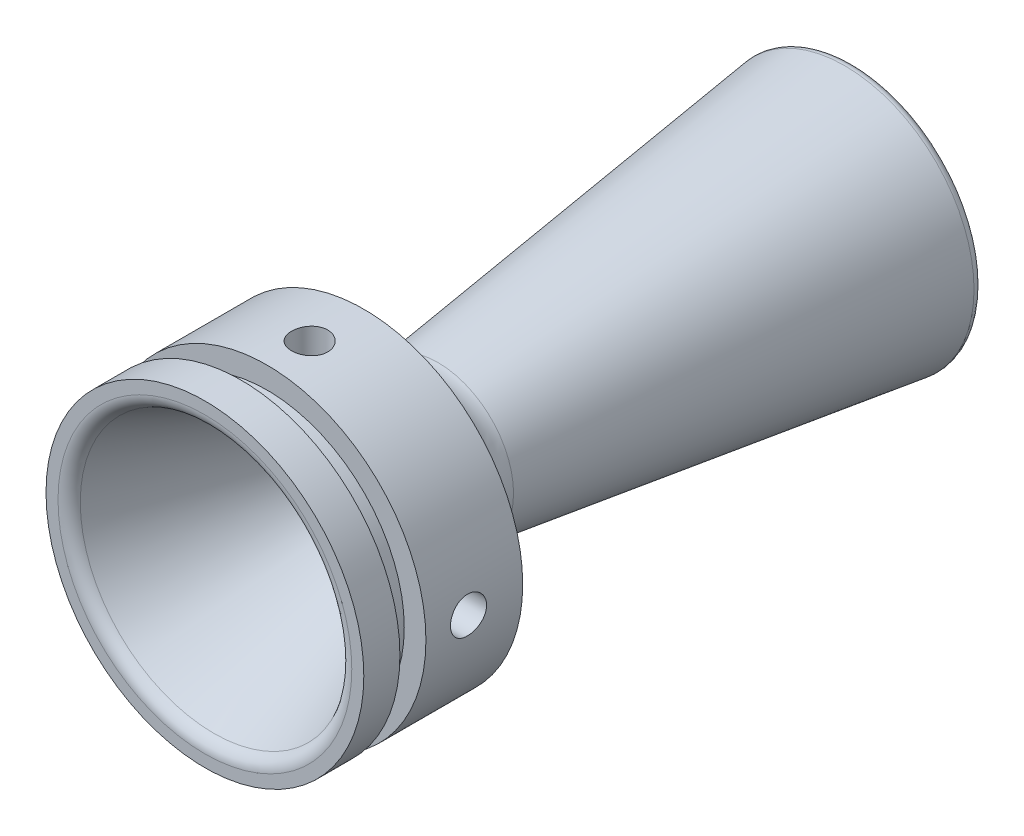
from build123d import *

# Parameters (mm, degrees)
FILETE5_R             = 1
ESBO_O2_R             = 2.5
CORTE_EXTRUS_O1_DEPTH = 5
PADR_OCIRCULAR1_COUNT = 4
FILETE6_R             = 5
FILETE7_R             = 1
FILETE8_R             = 2


with BuildPart() as part:
    # Esboço1 → Revolução1 (revolve)
    with BuildSketch(Plane(origin=(0, 0, 0), x_dir=(1, 0, 0), z_dir=(0, 1, 0))):
        Polygon((-7, -12.473975434), (-15, 48.292057468), (-18.025886882, 48.292057468), (-10.025886882, -12.473975434), (-22, -19.444538182), (-22, -32.844538182), (-19, -32.844538182), (-19, -36.444538182), (-22, -36.444538182), (-22, -41.444538182), (-19, -41.444538182), align=None)
    revolve(axis=Axis((0, 0, 0), (0, 0, -1)))

    # Filete5
    filete5_edges = [part.edges().sort_by_distance(p)[0] for p in [
        (7, 0, 12.473975434),
    ]]
    fillet(filete5_edges, radius=FILETE5_R)

    # Esboço2 → Corte-extrusão1 (cut)
    with BuildSketch(Plane.ZX.offset(22)):
        with Locations((26.944538182, 0)):
            Circle(ESBO_O2_R)
    corte_extrus_o1 = extrude(amount=-CORTE_EXTRUS_O1_DEPTH, mode=Mode.SUBTRACT)

    # PadrãoCircular1: Corte-extrusão1 ×4 about axis
    padr_ocircular1_axis = Axis((0, 0, 41.444538182), (0, 0, 1))
    for i in range(1, PADR_OCIRCULAR1_COUNT):
        add(corte_extrus_o1.rotate(padr_ocircular1_axis, i * 360 / PADR_OCIRCULAR1_COUNT), mode=Mode.SUBTRACT)

    # Filete6
    filete6_edges = [part.edges().sort_by_distance(p)[0] for p in [
        (10.025886882, 0, 12.473975434),
    ]]
    fillet(filete6_edges, radius=FILETE6_R)

    # Filete7
    filete7_edges = [part.edges().sort_by_distance(p)[0] for p in [
        (15, 0, -48.292057468),
        (18.025886882, 0, -48.292057468),
    ]]
    fillet(filete7_edges, radius=FILETE7_R)

    # Filete8
    filete8_edges = [part.edges().sort_by_distance(p)[0] for p in [
        (19, 0, 41.444538182),
    ]]
    fillet(filete8_edges, radius=FILETE8_R)


solid = part.part
